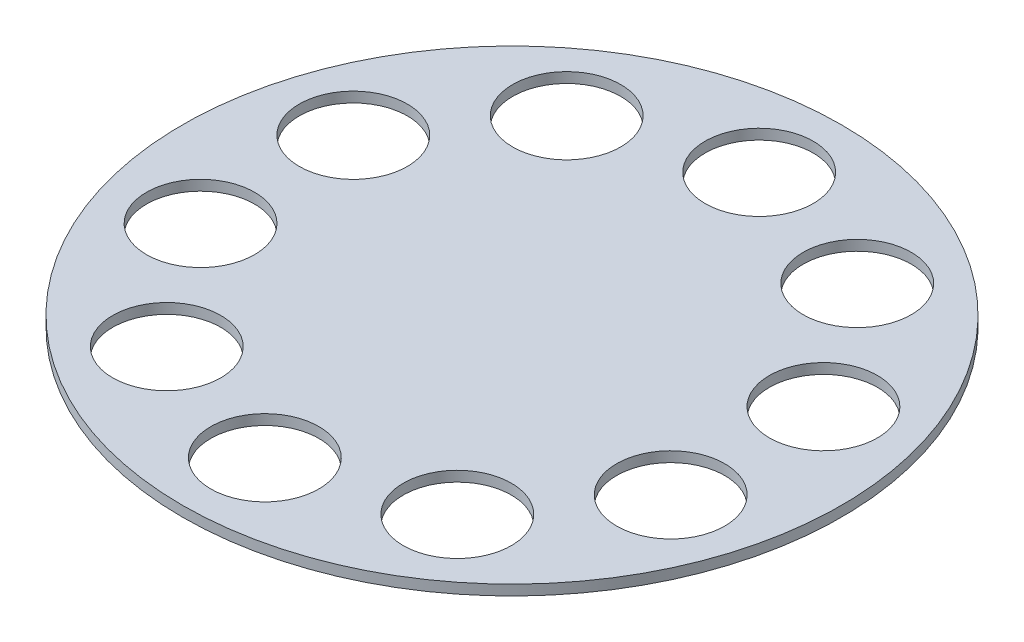
from build123d import *

# Parameters (mm, degrees)
SKETCH1_R           = 203.2
BOSS_EXTRUDE1_DEPTH = 6.35
SKETCH2_R           = 33.3375
CUT_EXTRUDE1_DEPTH  = 288.438345563


with BuildPart() as part:
    # Sketch1 → Boss-Extrude1 (new body)
    with BuildSketch(Plane(origin=(0, 0, 0), x_dir=(1, 0, 0), z_dir=(0, 1, 0))):
        with Locations(Location((0, 0, 0), (0, 0, 270))):
            Circle(SKETCH1_R)
    extrude(amount=BOSS_EXTRUDE1_DEPTH)

    # Sketch2 → Cut-Extrude1 (cut, through all)
    with BuildSketch(Plane(origin=(0, 6.35, 0), x_dir=(1, 0, 0), z_dir=(0, 1, 0))):
        with Locations(Location((0, 152.4, 0), (0, 0, 270))):
            Circle(SKETCH2_R)
        with Locations(Location((89.578472449, 123.294189943, 0), (0, 0, 270))):
            Circle(SKETCH2_R)
        with Locations(Location((144.941013083, 47.094189943, 0), (0, 0, 270))):
            Circle(SKETCH2_R)
        with Locations(Location((144.941013083, -47.094189943, 0), (0, 0, 270))):
            Circle(SKETCH2_R)
        with Locations(Location((89.578472449, -123.294189943, 0), (0, 0, 270))):
            Circle(SKETCH2_R)
        with Locations(Location((0, -152.4, 0), (0, 0, 270))):
            Circle(SKETCH2_R)
        with Locations(Location((-89.578472449, -123.294189943, 0), (0, 0, 270))):
            Circle(SKETCH2_R)
        with Locations(Location((-144.941013083, -47.094189943, 0), (0, 0, 270))):
            Circle(SKETCH2_R)
        with Locations(Location((-144.941013083, 47.094189943, 0), (0, 0, 270))):
            Circle(SKETCH2_R)
        with Locations(Location((-89.578472449, 123.294189943, 0), (0, 0, 270))):
            Circle(SKETCH2_R)
    extrude(amount=-CUT_EXTRUDE1_DEPTH, mode=Mode.SUBTRACT)


solid = part.part
